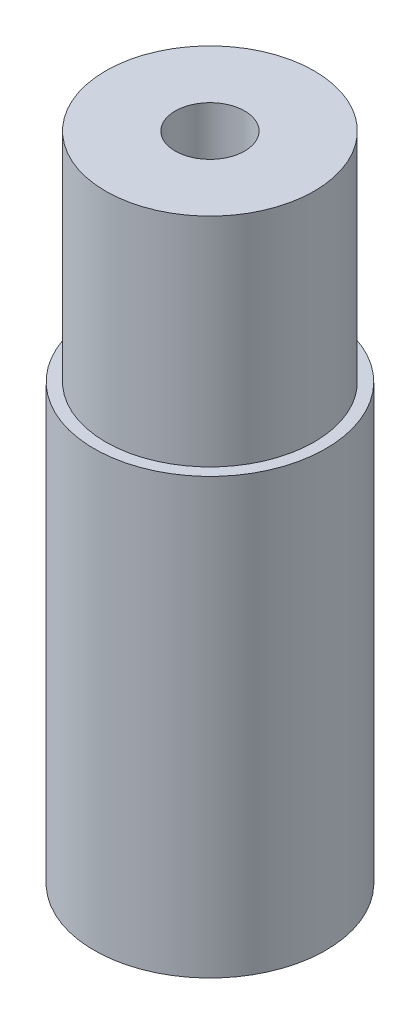
from build123d import *

# Parameters (mm, degrees)
SKETCH1_R           = 5.08
BOSS_EXTRUDE1_DEPTH = 19.05
SKETCH2_R           = 4.572
BOSS_EXTRUDE2_DEPTH = 9.525
SKETCH3_R           = 1.524
CUT_EXTRUDE1_DEPTH  = 4.699


with BuildPart() as part:
    # Sketch1 → Boss-Extrude1 (new body)
    with BuildSketch(Plane(origin=(0, 0, 0), x_dir=(1, 0, 0), z_dir=(0, 1, 0))):
        Circle(SKETCH1_R)
    extrude(amount=BOSS_EXTRUDE1_DEPTH)

    # Sketch2 → Boss-Extrude2 (add)
    with BuildSketch(Plane(origin=(0, 19.05, 0), x_dir=(1, 0, 0), z_dir=(0, 1, 0))):
        Circle(SKETCH2_R)
    extrude(amount=BOSS_EXTRUDE2_DEPTH)

    # Sketch3 → Cut-Extrude1 (cut)
    with BuildSketch(Plane(origin=(0, 28.575, 0), x_dir=(1, 0, 0), z_dir=(0, 1, 0))):
        Circle(SKETCH3_R)
    extrude(amount=-CUT_EXTRUDE1_DEPTH, mode=Mode.SUBTRACT)


solid = part.part
